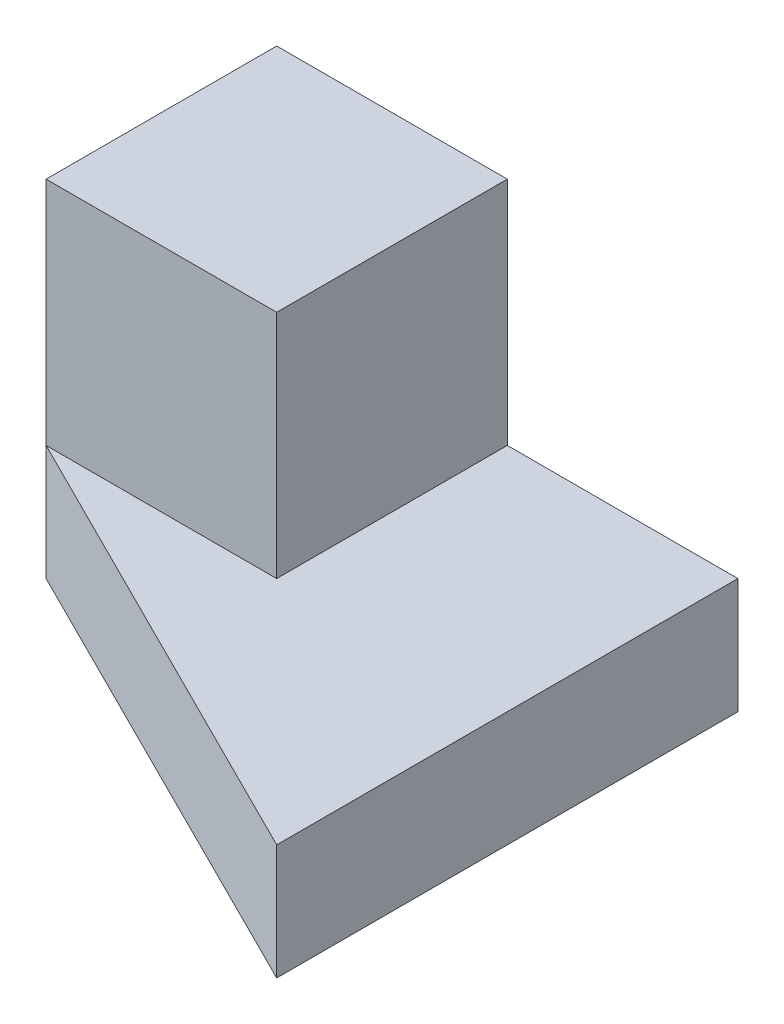
from build123d import *

# Parameters (mm, degrees)
EXTRUDE_1_DEPTH = 5
SKETCH_2_W      = 10
SKETCH_2_H      = 10
EXTRUDE_2_DEPTH = 10


with BuildPart() as part:
    # 草圖1 → 填料-伸長1 (new body)
    with BuildSketch(Plane(origin=(0, 0, 0), x_dir=(1, 0, 0), z_dir=(0, 1, 0))):
        Polygon((0, -10), (20, -20), (20, 0), (0, 0), align=None)
    extrude(amount=EXTRUDE_1_DEPTH)

    # 草圖2 → 填料-伸長2 (add)
    with BuildSketch(Plane(origin=(0, 5, 0), x_dir=(1, 0, 0), z_dir=(0, 1, 0))):
        with Locations((5, -5)):
            Rectangle(SKETCH_2_W, SKETCH_2_H)
    extrude(amount=EXTRUDE_2_DEPTH)


solid = part.part
